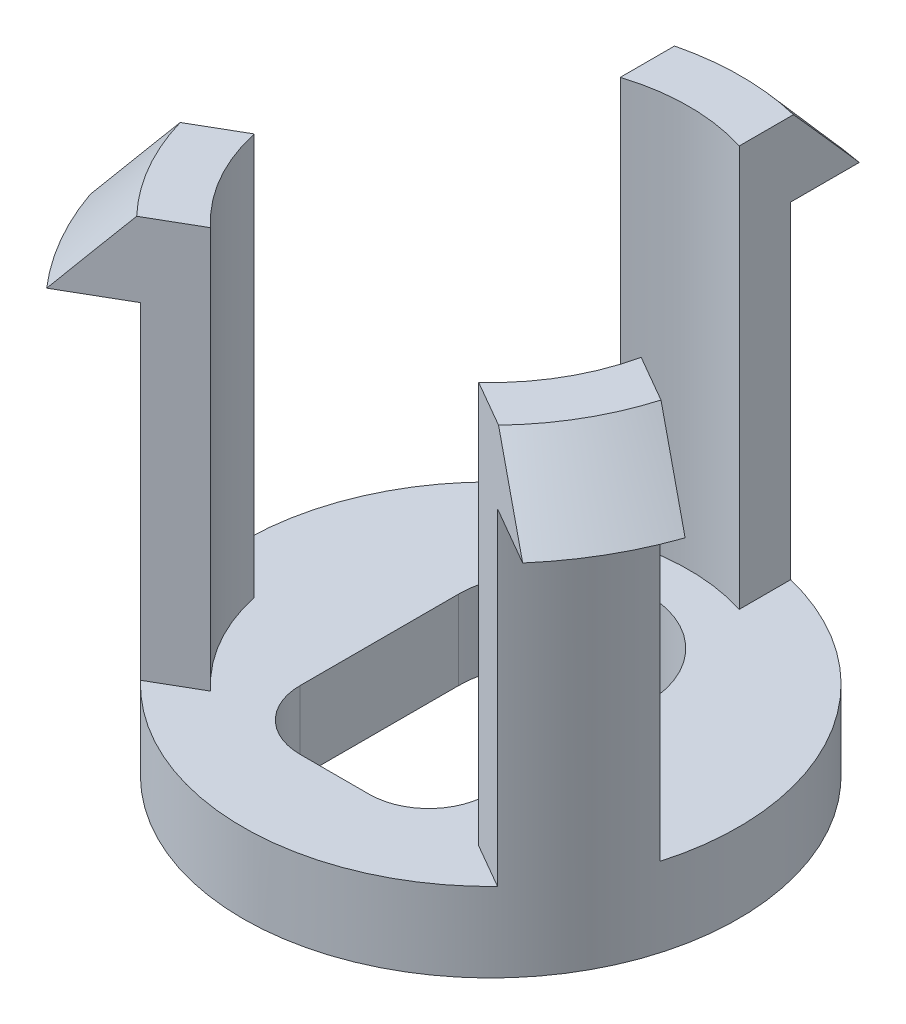
from build123d import *

# Parameters (mm, degrees)
SKETCH1_R           = 5
BOSS_EXTRUDE1_DEPTH = 1.6
BOSS_EXTRUDE2_DEPTH = 8.1
CIRPATTERN3_COUNT   = 3
CUT_EXTRUDE2_DEPTH  = 13.097652285
CUT_EXTRUDE3_DEPTH  = 13.164834188
CUT_EXTRUDE4_DEPTH  = 12.917406966
FILLET1_R           = 1.2


with BuildPart() as part:
    # Sketch1 → Boss-Extrude1 (new body)
    with BuildSketch(Plane(origin=(0, 0, 0), x_dir=(1, 0, 0), z_dir=(0, 1, 0))):
        with Locations(Location((0, 0, 0), (0, 0, 270))):
            Circle(SKETCH1_R)
    extrude(amount=BOSS_EXTRUDE1_DEPTH)

    # Sketch2 → Boss-Extrude2 (add)
    with BuildSketch(Plane(origin=(0, 1.6, 0), x_dir=(1, 0, 0), z_dir=(0, 1, 0))):
        with BuildLine():
            Line((-1.2, 4.85386444), (-1.2, 3.815756806))
            ThreePointArc((-1.2, 3.815756806), (0, 4), (1.2, 3.815756806))
            Line((1.2, 3.815756806), (1.2, 4.85386444))
            ThreePointArc((1.2, 4.85386444), (0, 5), (-1.2, 4.85386444))
        make_face()
    boss_extrude2 = extrude(amount=BOSS_EXTRUDE2_DEPTH)

    # CirPattern3: Boss-Extrude2 ×3 about axis
    cirpattern3_axis = Axis((0, 0, 0), (0, 1, 0))
    for i in range(1, CIRPATTERN3_COUNT):
        add(boss_extrude2.rotate(cirpattern3_axis, i * 360 / CIRPATTERN3_COUNT))

    # Sweep3: sweep along a path in Sketch6
    with BuildLine(Plane(origin=(0, 9.7, 0), x_dir=(1, 0, 0), z_dir=(0, 1, 0))) as sweep3_path:
        CenterArc((0, 0), 5, 0, 360)
    # Sketch3 → Sweep3 (sweep)
    with BuildSketch(Plane(origin=(0, 0, 0), x_dir=(0, 0, -1), z_dir=(1, 0, 0))):
        Polygon((5.05386444, 9.7), (6.35386444, 8.2), (4.85386444, 8.2), (4.85386444, 9.7), align=None)
    sweep(path=sweep3_path.line)

    # Sketch7 → Cut-Extrude2 (cut, through all)
    with BuildSketch(Plane(origin=(0, 1.6, 0), x_dir=(1, 0, 0), z_dir=(0, 1, 0))):
        with BuildLine():
            Line((-3.904542328, -0.868647918), (-4.803569911, -1.387701735))
            ThreePointArc((-4.803569911, -1.387701735), (-4.330127019, 2.5), (-1.2, 4.85386444))
            Line((-1.2, 4.85386444), (-1.2, 3.815756806))
            ThreePointArc((-1.2, 3.815756806), (0, 4), (1.2, 3.815756806))
            Line((1.2, 3.815756806), (1.2, 4.85386444))
            ThreePointArc((1.2, 4.85386444), (4.330127019, 2.5), (4.803569911, -1.387701735))
            Line((4.803569911, -1.387701735), (3.904542328, -0.868647918))
            ThreePointArc((3.904542328, -0.868647918), (3.464101615, -2), (2.704542328, -2.947108887))
            Line((2.704542328, -2.947108887), (3.603569911, -3.466162704))
            ThreePointArc((3.603569911, -3.466162704), (0, -5), (-3.603569911, -3.466162704))
            Line((-3.603569911, -3.466162704), (-2.704542328, -2.947108887))
            ThreePointArc((-2.704542328, -2.947108887), (-3.464101615, -2), (-3.904542328, -0.868647918))
        make_face()
    extrude(amount=CUT_EXTRUDE2_DEPTH, mode=Mode.SUBTRACT)

    # Sketch8 → Cut-Extrude3 (cut, through all)
    with BuildSketch(Plane.XZ.offset(-8.2)):
        with BuildLine():
            Line((-3.603569911, 3.466162704), (-4.803581682, 4.158989823))
            ThreePointArc((-4.803581682, 4.158989823), (0, 6.35386444), (4.803581682, 4.158989823))
            Line((4.803581682, 4.158989823), (3.603569911, 3.466162704))
            ThreePointArc((3.603569911, 3.466162704), (0, 5), (-3.603569911, 3.466162704))
        make_face()
        with BuildLine():
            Line((-6.003581682, 2.080528854), (-4.803569911, 1.387701735))
            ThreePointArc((-4.803569911, 1.387701735), (-4.330127019, -2.5), (-1.2, -4.85386444))
            Line((-1.2, -4.85386444), (-1.2, -6.239518677))
            ThreePointArc((-1.2, -6.239518677), (-5.502608017, -3.17693222), (-6.003581682, 2.080528854))
        make_face()
        with BuildLine():
            Line((1.2, -6.239518677), (1.2, -4.85386444))
            ThreePointArc((1.2, -4.85386444), (4.330127019, -2.5), (4.803569911, 1.387701735))
            Line((4.803569911, 1.387701735), (6.003581682, 2.080528854))
            ThreePointArc((6.003581682, 2.080528854), (5.502608017, -3.17693222), (1.2, -6.239518677))
        make_face()
    extrude(amount=-CUT_EXTRUDE3_DEPTH, mode=Mode.SUBTRACT)

    # Sketch9 → Cut-Extrude4 (cut, through all)
    with BuildSketch(Plane(origin=(0, 1.6, 0), x_dir=(1, 0, 0), z_dir=(0, 1, 0))):
        with BuildLine():
            Line((1.9, -3.15), (1.9, 1.25))
            ThreePointArc((1.9, 1.25), (0, 3.15), (-1.9, 1.25))
            Line((-1.9, 1.25), (-1.9, -3.15))
            Line((-1.9, -3.15), (1.9, -3.15))
        make_face()
    extrude(amount=-CUT_EXTRUDE4_DEPTH, mode=Mode.SUBTRACT)

    # Fillet1
    fillet1_edges = [part.edges().sort_by_distance(p)[0] for p in [
        (1.9, 0.8, 3.15),
        (-1.9, 0.8, 3.15),
    ]]
    fillet(fillet1_edges, radius=FILLET1_R)


solid = part.part
